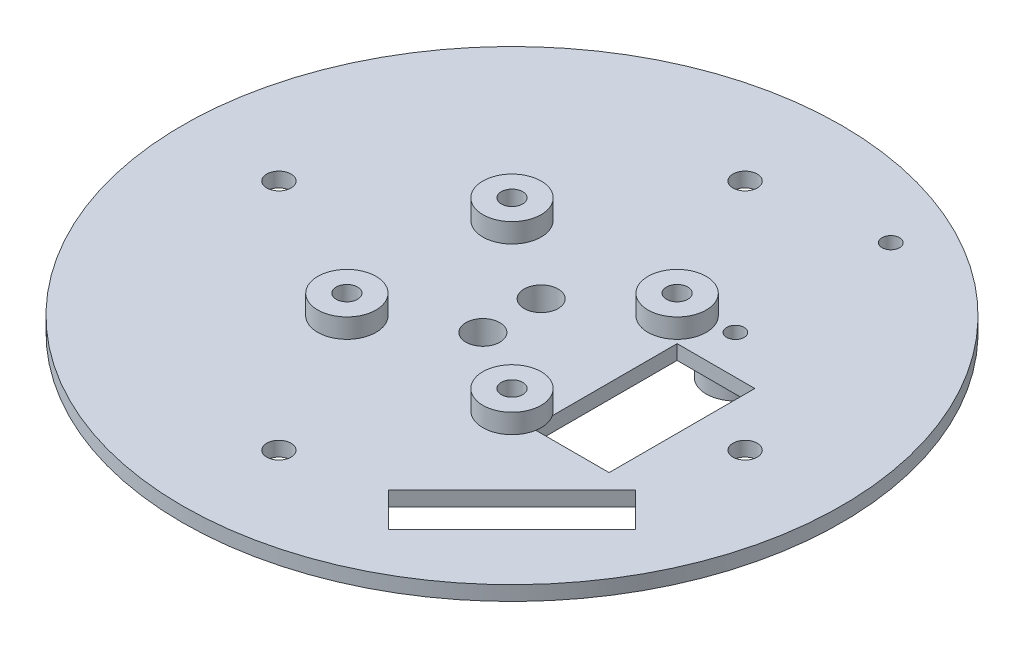
from build123d import *
from build123d.topology import SkipClean

# Parameters (mm, degrees)
SKETCH_1_R      = 33.929985128
SKETCH_1_R_2    = 1.25
SKETCH_1_R_3    = 1.1
SKETCH_1_R_4    = 1.75
SKETCH_1_R_5    = 0.9
SKETCH_1_W      = 8
SKETCH_1_H      = 15
EXTRUDE_1_DEPTH = 1.5
SKETCH_2_R      = 3
SKETCH_2_R_2    = 1.1
EXTRUDE_2_DEPTH = 2
EXTRUDE_START   = 1
SKETCH_3_W      = 10
SKETCH_3_H      = 15
SKETCH_3_R      = 1.75
EXTRUDE_3_DEPTH = 1
EXTRUDE_START_2 = 2.5
SKETCH_5_R      = 3
SKETCH_5_R_2    = 0.9
EXTRUDE_5_DEPTH = 2.5


with BuildPart() as part:
    # 草图1 → 凸台-拉伸1 (new body)
    with BuildSketch(Plane(origin=(0, 0, 0), x_dir=(1, 0, 0), z_dir=(0, 1, 0))):
        with Locations(Location((0, 0, 0), (0, 0, 270))):
            Circle(SKETCH_1_R)
        with Locations(Location((0, 24, 0), (0, 0, 270))):
            Circle(SKETCH_1_R_2, mode=Mode.SUBTRACT)
        with Locations(Location((24, 0, 0), (0, 0, 270))):
            Circle(SKETCH_1_R_2, mode=Mode.SUBTRACT)
        with Locations(Location((0, -24, 0), (0, 0, 270))):
            Circle(SKETCH_1_R_2, mode=Mode.SUBTRACT)
        with Locations(Location((-24, 0, 0), (0, 0, 270))):
            Circle(SKETCH_1_R_2, mode=Mode.SUBTRACT)
        with Locations(Location((8.5, 8.5, 0), (0, 0, 270))):
            Circle(SKETCH_1_R_3, mode=Mode.SUBTRACT)
        with Locations(Location((-8.5, 8.5, 0), (0, 0, 90))):
            Circle(SKETCH_1_R_3, mode=Mode.SUBTRACT)
        with Locations(Location((8.5, -8.5, 0), (0, 0, 90))):
            Circle(SKETCH_1_R_3, mode=Mode.SUBTRACT)
        with Locations(Location((-8.5, -8.5, 0), (0, 0, 270))):
            Circle(SKETCH_1_R_3, mode=Mode.SUBTRACT)
        with Locations(Location((0, 3, 0), (0, 0, 270))):
            Circle(SKETCH_1_R_4, mode=Mode.SUBTRACT)
        with Locations(Location((0, -3, 0), (0, 0, 270))):
            Circle(SKETCH_1_R_4, mode=Mode.SUBTRACT)
        with Locations(Location((13, 10, 0), (0, 0, 270))):
            Circle(SKETCH_1_R_5, mode=Mode.SUBTRACT)
        with Locations(Location((13, 26, 0), (0, 0, 90))):
            Circle(SKETCH_1_R_5, mode=Mode.SUBTRACT)
        Polygon((21.920310217, -9.192388155), (9.192388155, -21.920310217), (12.727922061, -25.455844123), (25.455844123, -12.727922061), align=None, mode=Mode.SUBTRACT)
        with Locations((15, -1.5)):
            Rectangle(SKETCH_1_W, SKETCH_1_H, mode=Mode.SUBTRACT)
    extrude(amount=EXTRUDE_1_DEPTH)

    # 草图2 → 凸台-拉伸2 (add)
    # profile 1 of 4: a face of its own
    with BuildSketch(Plane(origin=(0, 1.5, 0), x_dir=(1, 0, 0), z_dir=(0, 1, 0))):
        with Locations(Location((-8.5, 8.5, 0), (0, 0, 270))):
            Circle(SKETCH_2_R)
        with Locations(Location((-8.5, 8.5, 0), (0, 0, 90))):
            Circle(SKETCH_2_R_2, mode=Mode.SUBTRACT)
    # profile 2 of 4: a face of its own
    with BuildSketch(Plane(origin=(0, 1.5, 0), x_dir=(1, 0, 0), z_dir=(0, 1, 0))):
        with Locations(Location((8.5, 8.5, 0), (0, 0, 270))):
            Circle(SKETCH_2_R)
        with Locations(Location((8.5, 8.5, 0), (0, 0, 270))):
            Circle(SKETCH_2_R_2, mode=Mode.SUBTRACT)
    # profile 3 of 4: a face of its own
    with BuildSketch(Plane(origin=(0, 1.5, 0), x_dir=(1, 0, 0), z_dir=(0, 1, 0))):
        with Locations(Location((8.5, -8.5, 0), (0, 0, 33.557309762))):
            Circle(SKETCH_2_R)
        with Locations(Location((8.5, -8.5, 0), (0, 0, 90))):
            Circle(SKETCH_2_R_2, mode=Mode.SUBTRACT)
    # profile 4 of 4: a face of its own
    with BuildSketch(Plane(origin=(0, 1.5, 0), x_dir=(1, 0, 0), z_dir=(0, 1, 0))):
        with Locations(Location((-8.5, -8.5, 0), (0, 0, 270))):
            Circle(SKETCH_2_R)
        with Locations(Location((-8.5, -8.5, 0), (0, 0, 270))):
            Circle(SKETCH_2_R_2, mode=Mode.SUBTRACT)
    extrude(amount=EXTRUDE_2_DEPTH)

    # 草图3 → 凸台-拉伸3 (add)
    with SkipClean():  # the faces are left unmerged after this step: merging them gives an invalid solid
        with BuildSketch(Plane.XZ.offset(EXTRUDE_START)):
            with Locations((0, 0.5)):
                Rectangle(SKETCH_3_W, SKETCH_3_H)
            with Locations(Location((0, 3, 0), (0, 0, 270))):
                Circle(SKETCH_3_R, mode=Mode.SUBTRACT)
            with Locations(Location((0, -3, 0), (0, 0, 270))):
                Circle(SKETCH_3_R, mode=Mode.SUBTRACT)
        extrude(amount=-EXTRUDE_3_DEPTH)

    # 草图5 → 凸台-拉伸5 (add)
    # profile 1 of 2: a face of its own
    with SkipClean():  # the faces are left unmerged after this step: merging them gives an invalid solid
        with BuildSketch(Plane.XZ.offset(EXTRUDE_START_2)):
            with Locations(Location((13, -26, 0), (0, 0, 90))):
                Circle(SKETCH_5_R)
            with Locations(Location((13, -26, 0), (0, 0, 270))):
                Circle(SKETCH_5_R_2, mode=Mode.SUBTRACT)
        # profile 2 of 2: a face of its own
        with BuildSketch(Plane.XZ.offset(EXTRUDE_START_2)):
            with Locations(Location((13, -10, 0), (0, 0, 90))):
                Circle(SKETCH_5_R)
            with Locations(Location((13, -10, 0), (0, 0, 270))):
                Circle(SKETCH_5_R_2, mode=Mode.SUBTRACT)
        extrude(amount=-EXTRUDE_5_DEPTH)


solid = part.part
